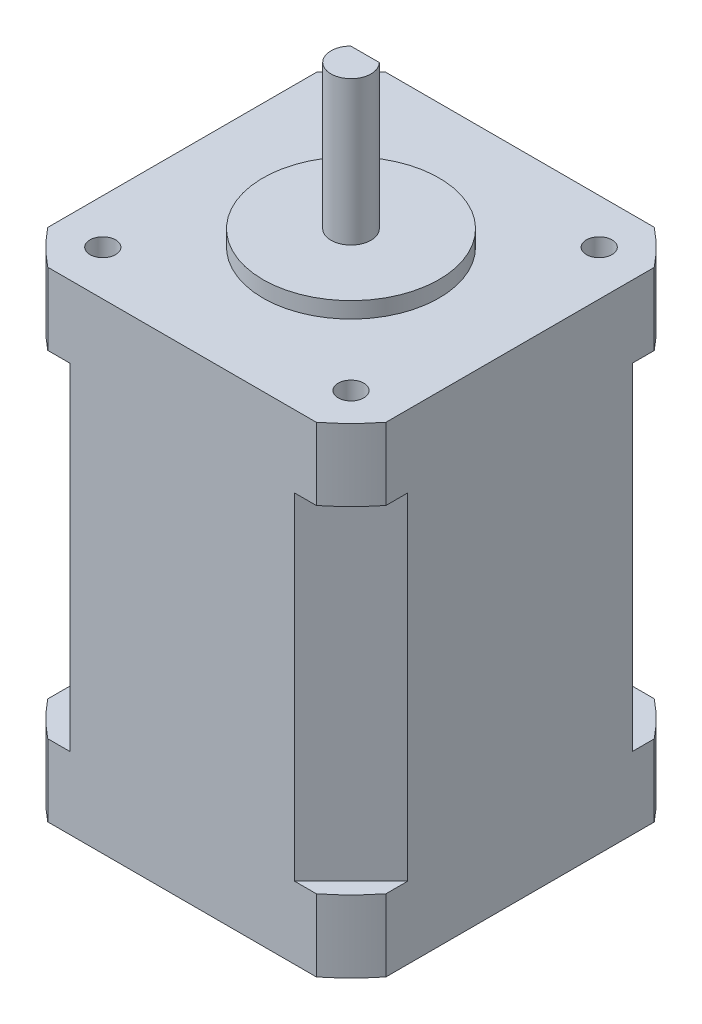
from build123d import *

# Parameters (mm, degrees)
EXTRUDE_1_DEPTH     = 60
EXTRUDE_2_DEPTH     = 9
SKETCH_7_R          = 11
EXTRUDE_3_DEPTH     = 2
SKETCH_8_R          = 2.5
EXTRUDE_4_DEPTH     = 18
CUT_EXTRUDE_START   = -15
CUT_EXTRUDE_1_DEPTH = 15
SKETCH_10_R         = 1.6
CUT_EXTRUDE_2_DEPTH = 4.5


with BuildPart() as part:
    # 草图2 → 凸台-拉伸1 (new body)
    with BuildSketch(Plane(origin=(0, 0, 0), x_dir=(1, 0, 0), z_dir=(0, 1, 0))):
        Polygon((-14.012734328, 22.447763171), (-21.08380214, 15.376695359), (-21.08380214, -12.681169017), (-14.012734328, -19.752236829), (14.045130048, -19.752236829), (21.11619786, -12.681169017), (21.11619786, 15.376695359), (14.045130048, 22.447763171), align=None)
    extrude(amount=EXTRUDE_1_DEPTH)

    # 草图5 → 凸台-拉伸2 (add)
    with BuildSketch(Plane(origin=(0, 60, 0), x_dir=(1, 0, 0), z_dir=(0, 1, 0))):
        with BuildLine():
            Line((-16.776242784, 22.447763171), (16.776242784, 22.447763171))
            ThreePointArc((16.776242784, 22.447763171), (19.070321818, 20.399669839), (21.11619786, 18.103613191))
            Line((21.11619786, 18.103613191), (21.11619786, -15.408086849))
            ThreePointArc((21.11619786, -15.408086849), (19.070321818, -17.704143498), (16.776242784, -19.752236829))
            Line((16.776242784, -19.752236829), (-16.776242784, -19.752236829))
            ThreePointArc((-16.776242784, -19.752236829), (-19.051917848, -17.722547478), (-21.08380214, -15.448831998))
            Line((-21.08380214, -15.448831998), (-21.08380214, 18.14435834))
            ThreePointArc((-21.08380214, 18.14435834), (-19.051917848, 20.41807382), (-16.776242784, 22.447763171))
        make_face()
    extrude_2 = extrude(amount=-EXTRUDE_2_DEPTH)

    # 镜向1: 凸台-拉伸2 across plane
    add(extrude_2.mirror(Plane.ZX.offset(30)))

    # 草图7 → 凸台-拉伸3 (add)
    with BuildSketch(Plane(origin=(0, 60, 0), x_dir=(1, 0, 0), z_dir=(0, 1, 0))):
        with Locations(Location((0, 1.347763171, 0), (0, 0, 270))):
            Circle(SKETCH_7_R)
    extrude(amount=EXTRUDE_3_DEPTH)

    # 草图8 → 凸台-拉伸4 (add)
    with BuildSketch(Plane(origin=(0, 62, 0), x_dir=(1, 0, 0), z_dir=(0, 1, 0))):
        with Locations(Location((0, 1.347763171, 0), (0, 0, 270))):
            Circle(SKETCH_8_R)
    extrude(amount=EXTRUDE_4_DEPTH)

    # 草图9 → 切除-拉伸1 (cut)
    with BuildSketch(Plane(origin=(0, 80, 0), x_dir=(1, 0, 0), z_dir=(0, 1, 0)).offset(CUT_EXTRUDE_START)):
        with BuildLine():
            Line((-1.785357107, 3.097763171), (1.785357107, 3.097763171))
            ThreePointArc((1.785357107, 3.097763171), (0, 3.847763171), (-1.785357107, 3.097763171))
        make_face()
    extrude(amount=CUT_EXTRUDE_1_DEPTH, mode=Mode.SUBTRACT)

    # 草图10 → 切除-拉伸2 (cut)
    with BuildSketch(Plane(origin=(0, 60, 0), x_dir=(1, 0, 0), z_dir=(0, 1, 0))):
        with Locations(Location((-15.5, 16.847763171, 0), (0, 0, 270))):
            Circle(SKETCH_10_R)
        with Locations(Location((15.5, 16.847763171, 0), (0, 0, 270))):
            Circle(SKETCH_10_R)
        with Locations(Location((15.5, -14.152236829, 0), (0, 0, 270))):
            Circle(SKETCH_10_R)
        with Locations(Location((-15.5, -14.152236829, 0), (0, 0, 270))):
            Circle(SKETCH_10_R)
    extrude(amount=-CUT_EXTRUDE_2_DEPTH, mode=Mode.SUBTRACT)


solid = part.part
